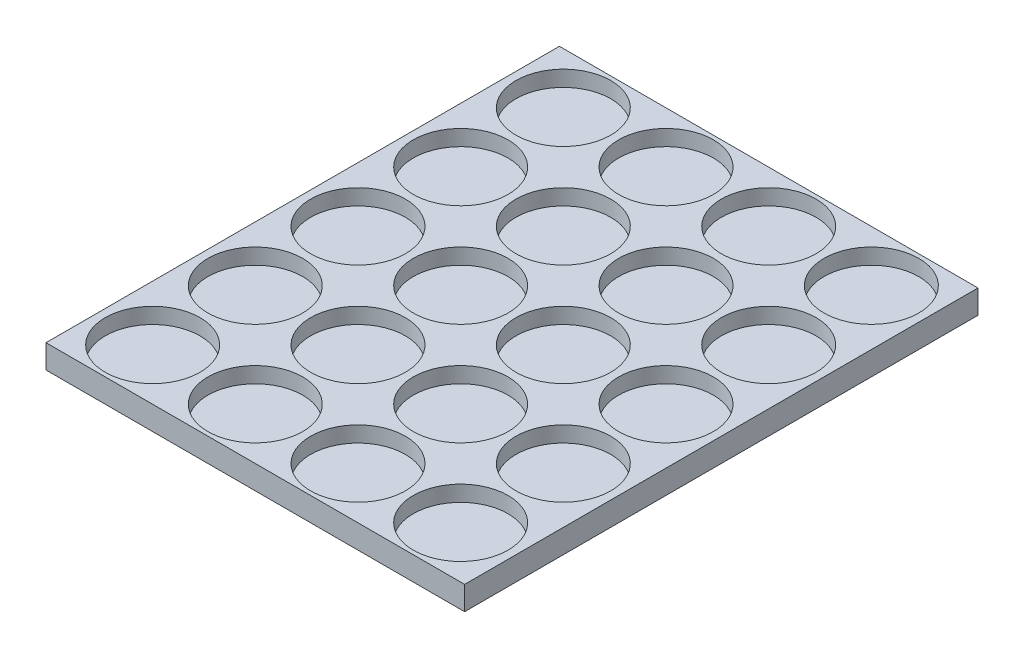
from build123d import *

# Parameters (mm, degrees)
TPS_SILIKON_GN21_20_CUKUR_1_START  = 9
SKETCH1_W                          = 530
SKETCH1_H                          = 650
TPS_SILIKON_GN21_20_CUKUR_1_DEPTH  = 30
TPS_SILIKON_GN21_20_CUKUR_2_START  = 19
SKETCH2_R                          = 60
TPS_SILIKON_GN21_20_CUKUR_2_DEPTH  = 21
TPS_SILIKON_GN21_20_CUKUR_3_START  = 19
SKETCH3_R                          = 60
TPS_SILIKON_GN21_20_CUKUR_3_DEPTH  = 21
TPS_SILIKON_GN21_20_CUKUR_4_START  = 19
SKETCH4_R                          = 60
TPS_SILIKON_GN21_20_CUKUR_4_DEPTH  = 21
TPS_SILIKON_GN21_20_CUKUR_5_START  = 19
SKETCH5_R                          = 60
TPS_SILIKON_GN21_20_CUKUR_5_DEPTH  = 21
TPS_SILIKON_GN21_20_CUKUR_6_START  = 19
SKETCH6_R                          = 60
TPS_SILIKON_GN21_20_CUKUR_6_DEPTH  = 21
TPS_SILIKON_GN21_20_CUKUR_7_START  = 19
SKETCH7_R                          = 60
TPS_SILIKON_GN21_20_CUKUR_7_DEPTH  = 21
TPS_SILIKON_GN21_20_CUKUR_8_START  = 19
SKETCH8_R                          = 60
TPS_SILIKON_GN21_20_CUKUR_8_DEPTH  = 21
TPS_SILIKON_GN21_20_CUKUR_9_START  = 19
SKETCH9_R                          = 60
TPS_SILIKON_GN21_20_CUKUR_9_DEPTH  = 21
TPS_SILIKON_GN21_20_CUKUR_10_START = 19
SKETCH10_R                         = 60
TPS_SILIKON_GN21_20_CUKUR_10_DEPTH = 21
TPS_SILIKON_GN21_20_CUKUR_11_START = 19
SKETCH11_R                         = 60
TPS_SILIKON_GN21_20_CUKUR_11_DEPTH = 21
TPS_SILIKON_GN21_20_CUKUR_12_START = 19
SKETCH12_R                         = 60
TPS_SILIKON_GN21_20_CUKUR_12_DEPTH = 21
TPS_SILIKON_GN21_20_CUKUR_13_START = 19
SKETCH13_R                         = 60
TPS_SILIKON_GN21_20_CUKUR_13_DEPTH = 21
TPS_SILIKON_GN21_20_CUKUR_14_START = 19
SKETCH14_R                         = 60
TPS_SILIKON_GN21_20_CUKUR_14_DEPTH = 21
TPS_SILIKON_GN21_20_CUKUR_15_START = 19
SKETCH15_R                         = 60
TPS_SILIKON_GN21_20_CUKUR_15_DEPTH = 21
TPS_SILIKON_GN21_20_CUKUR_16_START = 19
SKETCH16_R                         = 60
TPS_SILIKON_GN21_20_CUKUR_16_DEPTH = 21
TPS_SILIKON_GN21_20_CUKUR_17_START = 19
SKETCH17_R                         = 60
TPS_SILIKON_GN21_20_CUKUR_17_DEPTH = 21
TPS_SILIKON_GN21_20_CUKUR_18_START = 19
SKETCH18_R                         = 60
TPS_SILIKON_GN21_20_CUKUR_18_DEPTH = 21
TPS_SILIKON_GN21_20_CUKUR_19_START = 19
SKETCH19_R                         = 60
TPS_SILIKON_GN21_20_CUKUR_19_DEPTH = 21
TPS_SILIKON_GN21_20_CUKUR_20_START = 19
SKETCH20_R                         = 60
TPS_SILIKON_GN21_20_CUKUR_20_DEPTH = 21
TPS_SILIKON_GN21_20_CUKUR_21_START = 19
SKETCH21_R                         = 60
TPS_SILIKON_GN21_20_CUKUR_21_DEPTH = 21


with BuildPart() as part:
    # Sketch1 → TPS_silikon_GN21_20_cukur_1 (new body)
    with BuildSketch(Plane(origin=(0, 0, 0), x_dir=(1, 0, 0), z_dir=(0, 1, 0)).offset(TPS_SILIKON_GN21_20_CUKUR_1_START)):
        with Locations((309, 350)):
            Rectangle(SKETCH1_W, SKETCH1_H)
    extrude(amount=TPS_SILIKON_GN21_20_CUKUR_1_DEPTH)

    # Sketch2 → TPS_silikon_GN21_20_cukur_2 (cut)
    with BuildSketch(Plane(origin=(0, 0, 0), x_dir=(1, 0, 0), z_dir=(0, 1, 0)).offset(TPS_SILIKON_GN21_20_CUKUR_2_START)):
        with Locations(Location((114, 610, 0), (0, 0, 90))):
            Circle(SKETCH2_R)
    extrude(amount=TPS_SILIKON_GN21_20_CUKUR_2_DEPTH, mode=Mode.SUBTRACT)

    # Sketch3 → TPS_silikon_GN21_20_cukur_3 (cut)
    with BuildSketch(Plane(origin=(0, 0, 0), x_dir=(1, 0, 0), z_dir=(0, 1, 0)).offset(TPS_SILIKON_GN21_20_CUKUR_3_START)):
        with Locations(Location((114, 480, 0), (0, 0, 90))):
            Circle(SKETCH3_R)
    extrude(amount=TPS_SILIKON_GN21_20_CUKUR_3_DEPTH, mode=Mode.SUBTRACT)

    # Sketch4 → TPS_silikon_GN21_20_cukur_4 (cut)
    with BuildSketch(Plane(origin=(0, 0, 0), x_dir=(1, 0, 0), z_dir=(0, 1, 0)).offset(TPS_SILIKON_GN21_20_CUKUR_4_START)):
        with Locations(Location((114, 350, 0), (0, 0, 90))):
            Circle(SKETCH4_R)
    extrude(amount=TPS_SILIKON_GN21_20_CUKUR_4_DEPTH, mode=Mode.SUBTRACT)

    # Sketch5 → TPS_silikon_GN21_20_cukur_5 (cut)
    with BuildSketch(Plane(origin=(0, 0, 0), x_dir=(1, 0, 0), z_dir=(0, 1, 0)).offset(TPS_SILIKON_GN21_20_CUKUR_5_START)):
        with Locations(Location((114, 220, 0), (0, 0, 90))):
            Circle(SKETCH5_R)
    extrude(amount=TPS_SILIKON_GN21_20_CUKUR_5_DEPTH, mode=Mode.SUBTRACT)

    # Sketch6 → TPS_silikon_GN21_20_cukur_6 (cut)
    with BuildSketch(Plane(origin=(0, 0, 0), x_dir=(1, 0, 0), z_dir=(0, 1, 0)).offset(TPS_SILIKON_GN21_20_CUKUR_6_START)):
        with Locations(Location((114, 90, 0), (0, 0, 90))):
            Circle(SKETCH6_R)
    extrude(amount=TPS_SILIKON_GN21_20_CUKUR_6_DEPTH, mode=Mode.SUBTRACT)

    # Sketch7 → TPS_silikon_GN21_20_cukur_7 (cut)
    with BuildSketch(Plane(origin=(0, 0, 0), x_dir=(1, 0, 0), z_dir=(0, 1, 0)).offset(TPS_SILIKON_GN21_20_CUKUR_7_START)):
        with Locations(Location((244, 610, 0), (0, 0, 90))):
            Circle(SKETCH7_R)
    extrude(amount=TPS_SILIKON_GN21_20_CUKUR_7_DEPTH, mode=Mode.SUBTRACT)

    # Sketch8 → TPS_silikon_GN21_20_cukur_8 (cut)
    with BuildSketch(Plane(origin=(0, 0, 0), x_dir=(1, 0, 0), z_dir=(0, 1, 0)).offset(TPS_SILIKON_GN21_20_CUKUR_8_START)):
        with Locations(Location((244, 480, 0), (0, 0, 90))):
            Circle(SKETCH8_R)
    extrude(amount=TPS_SILIKON_GN21_20_CUKUR_8_DEPTH, mode=Mode.SUBTRACT)

    # Sketch9 → TPS_silikon_GN21_20_cukur_9 (cut)
    with BuildSketch(Plane(origin=(0, 0, 0), x_dir=(1, 0, 0), z_dir=(0, 1, 0)).offset(TPS_SILIKON_GN21_20_CUKUR_9_START)):
        with Locations(Location((244, 350, 0), (0, 0, 90))):
            Circle(SKETCH9_R)
    extrude(amount=TPS_SILIKON_GN21_20_CUKUR_9_DEPTH, mode=Mode.SUBTRACT)

    # Sketch10 → TPS_silikon_GN21_20_cukur_10 (cut)
    with BuildSketch(Plane(origin=(0, 0, 0), x_dir=(1, 0, 0), z_dir=(0, 1, 0)).offset(TPS_SILIKON_GN21_20_CUKUR_10_START)):
        with Locations(Location((244, 220, 0), (0, 0, 90))):
            Circle(SKETCH10_R)
    extrude(amount=TPS_SILIKON_GN21_20_CUKUR_10_DEPTH, mode=Mode.SUBTRACT)

    # Sketch11 → TPS_silikon_GN21_20_cukur_11 (cut)
    with BuildSketch(Plane(origin=(0, 0, 0), x_dir=(1, 0, 0), z_dir=(0, 1, 0)).offset(TPS_SILIKON_GN21_20_CUKUR_11_START)):
        with Locations(Location((244, 90, 0), (0, 0, 90))):
            Circle(SKETCH11_R)
    extrude(amount=TPS_SILIKON_GN21_20_CUKUR_11_DEPTH, mode=Mode.SUBTRACT)

    # Sketch12 → TPS_silikon_GN21_20_cukur_12 (cut)
    with BuildSketch(Plane(origin=(0, 0, 0), x_dir=(1, 0, 0), z_dir=(0, 1, 0)).offset(TPS_SILIKON_GN21_20_CUKUR_12_START)):
        with Locations(Location((374, 610, 0), (0, 0, 90))):
            Circle(SKETCH12_R)
    extrude(amount=TPS_SILIKON_GN21_20_CUKUR_12_DEPTH, mode=Mode.SUBTRACT)

    # Sketch13 → TPS_silikon_GN21_20_cukur_13 (cut)
    with BuildSketch(Plane(origin=(0, 0, 0), x_dir=(1, 0, 0), z_dir=(0, 1, 0)).offset(TPS_SILIKON_GN21_20_CUKUR_13_START)):
        with Locations(Location((374, 480, 0), (0, 0, 90))):
            Circle(SKETCH13_R)
    extrude(amount=TPS_SILIKON_GN21_20_CUKUR_13_DEPTH, mode=Mode.SUBTRACT)

    # Sketch14 → TPS_silikon_GN21_20_cukur_14 (cut)
    with BuildSketch(Plane(origin=(0, 0, 0), x_dir=(1, 0, 0), z_dir=(0, 1, 0)).offset(TPS_SILIKON_GN21_20_CUKUR_14_START)):
        with Locations(Location((374, 350, 0), (0, 0, 90))):
            Circle(SKETCH14_R)
    extrude(amount=TPS_SILIKON_GN21_20_CUKUR_14_DEPTH, mode=Mode.SUBTRACT)

    # Sketch15 → TPS_silikon_GN21_20_cukur_15 (cut)
    with BuildSketch(Plane(origin=(0, 0, 0), x_dir=(1, 0, 0), z_dir=(0, 1, 0)).offset(TPS_SILIKON_GN21_20_CUKUR_15_START)):
        with Locations(Location((374, 220, 0), (0, 0, 90))):
            Circle(SKETCH15_R)
    extrude(amount=TPS_SILIKON_GN21_20_CUKUR_15_DEPTH, mode=Mode.SUBTRACT)

    # Sketch16 → TPS_silikon_GN21_20_cukur_16 (cut)
    with BuildSketch(Plane(origin=(0, 0, 0), x_dir=(1, 0, 0), z_dir=(0, 1, 0)).offset(TPS_SILIKON_GN21_20_CUKUR_16_START)):
        with Locations(Location((374, 90, 0), (0, 0, 90))):
            Circle(SKETCH16_R)
    extrude(amount=TPS_SILIKON_GN21_20_CUKUR_16_DEPTH, mode=Mode.SUBTRACT)

    # Sketch17 → TPS_silikon_GN21_20_cukur_17 (cut)
    with BuildSketch(Plane(origin=(0, 0, 0), x_dir=(1, 0, 0), z_dir=(0, 1, 0)).offset(TPS_SILIKON_GN21_20_CUKUR_17_START)):
        with Locations(Location((504, 610, 0), (0, 0, 90))):
            Circle(SKETCH17_R)
    extrude(amount=TPS_SILIKON_GN21_20_CUKUR_17_DEPTH, mode=Mode.SUBTRACT)

    # Sketch18 → TPS_silikon_GN21_20_cukur_18 (cut)
    with BuildSketch(Plane(origin=(0, 0, 0), x_dir=(1, 0, 0), z_dir=(0, 1, 0)).offset(TPS_SILIKON_GN21_20_CUKUR_18_START)):
        with Locations(Location((504, 480, 0), (0, 0, 90))):
            Circle(SKETCH18_R)
    extrude(amount=TPS_SILIKON_GN21_20_CUKUR_18_DEPTH, mode=Mode.SUBTRACT)

    # Sketch19 → TPS_silikon_GN21_20_cukur_19 (cut)
    with BuildSketch(Plane(origin=(0, 0, 0), x_dir=(1, 0, 0), z_dir=(0, 1, 0)).offset(TPS_SILIKON_GN21_20_CUKUR_19_START)):
        with Locations(Location((504, 350, 0), (0, 0, 90))):
            Circle(SKETCH19_R)
    extrude(amount=TPS_SILIKON_GN21_20_CUKUR_19_DEPTH, mode=Mode.SUBTRACT)

    # Sketch20 → TPS_silikon_GN21_20_cukur_20 (cut)
    with BuildSketch(Plane(origin=(0, 0, 0), x_dir=(1, 0, 0), z_dir=(0, 1, 0)).offset(TPS_SILIKON_GN21_20_CUKUR_20_START)):
        with Locations(Location((504, 220, 0), (0, 0, 90))):
            Circle(SKETCH20_R)
    extrude(amount=TPS_SILIKON_GN21_20_CUKUR_20_DEPTH, mode=Mode.SUBTRACT)

    # Sketch21 → TPS_silikon_GN21_20_cukur_21 (cut)
    with BuildSketch(Plane(origin=(0, 0, 0), x_dir=(1, 0, 0), z_dir=(0, 1, 0)).offset(TPS_SILIKON_GN21_20_CUKUR_21_START)):
        with Locations(Location((504, 90, 0), (0, 0, 90))):
            Circle(SKETCH21_R)
    extrude(amount=TPS_SILIKON_GN21_20_CUKUR_21_DEPTH, mode=Mode.SUBTRACT)


solid = part.part
